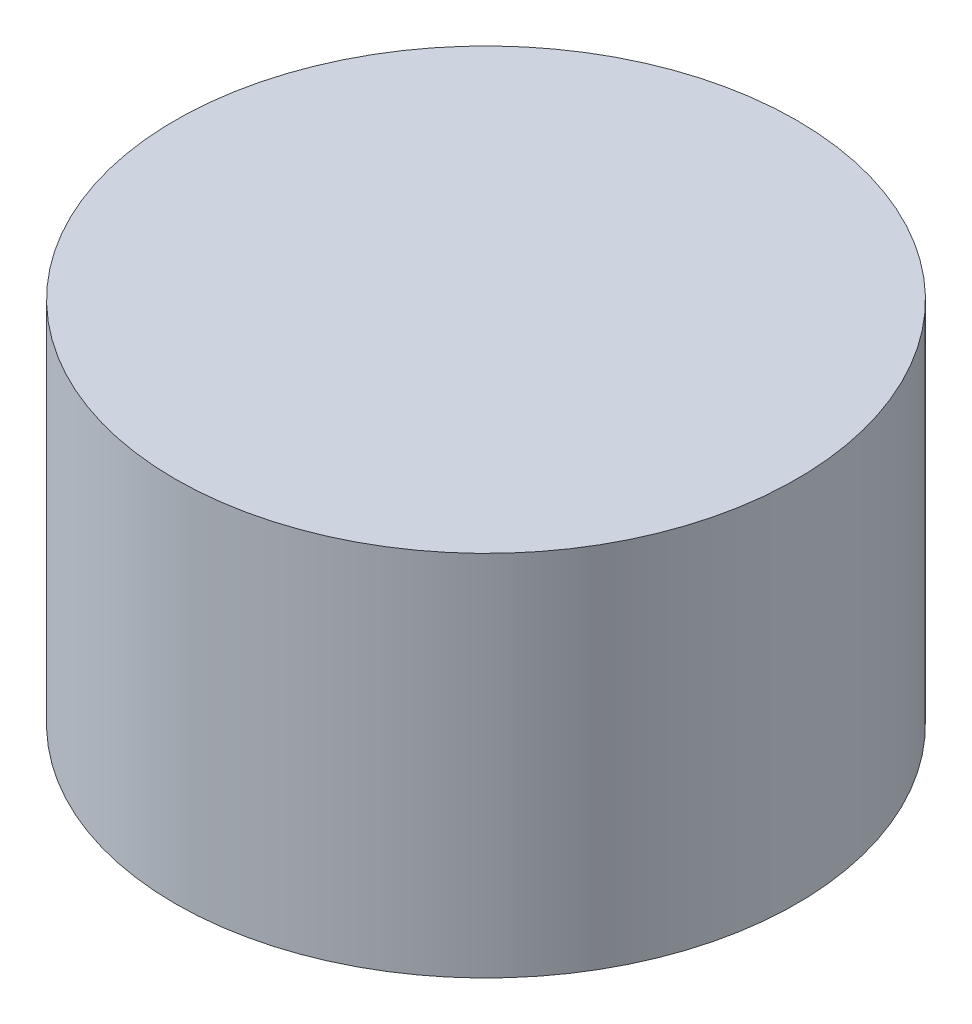
from build123d import *

# Parameters (mm, degrees)
SKETCH1_R           = 8.45
BOSS_EXTRUDE1_DEPTH = 10


with BuildPart() as part:
    # Sketch1 → Boss-Extrude1 (new body)
    with BuildSketch(Plane(origin=(0, 0, 0), x_dir=(1, 0, 0), z_dir=(0, 1, 0))):
        with Locations(Location((-31.573861931, 9.75152664, 0), (0, 0, 270))):
            Circle(SKETCH1_R)
    extrude(amount=BOSS_EXTRUDE1_DEPTH)


solid = part.part
